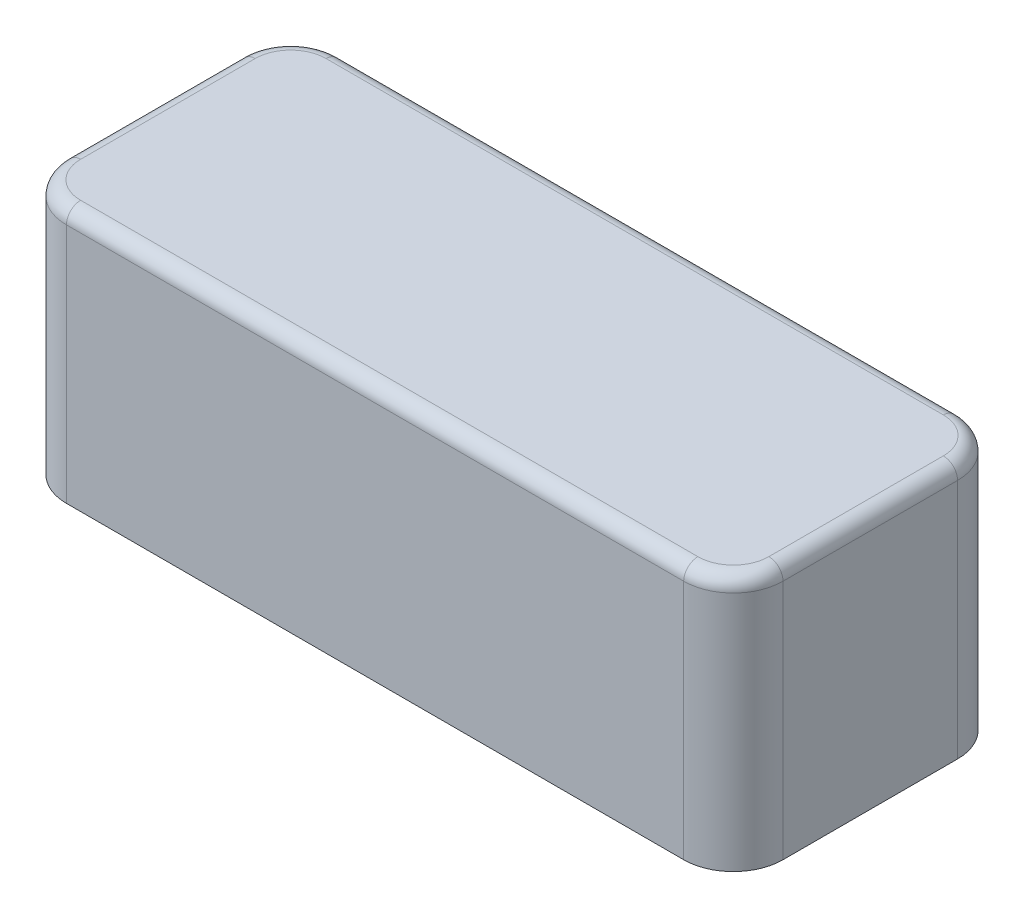
from build123d import *

# Parameters (mm, degrees)
BOSS_EXTRUDE1_DEPTH = 350
BOSS_EXTRUDE2_DEPTH = 10
FILLET1_R           = 20


with BuildPart() as part:
    # Sketch1 → Boss-Extrude1 (new body)
    with BuildSketch(Plane(origin=(0, 0, 0), x_dir=(1, 0, 0), z_dir=(0, 1, 0))):
        with BuildLine():
            Line((-505, -123), (-505, 123))
            ThreePointArc((-505, 123), (-484.497474683, 172.497474683), (-435, 193))
            Line((-435, 193), (435, 193))
            ThreePointArc((435, 193), (484.497474683, 172.497474683), (505, 123))
            Line((505, 123), (505, -123))
            ThreePointArc((505, -123), (484.497474683, -172.497474683), (435, -193))
            Line((435, -193), (-435, -193))
            ThreePointArc((-435, -193), (-484.497474683, -172.497474683), (-505, -123))
        make_face()
        with BuildLine():
            ThreePointArc((495, 123), (477.426406871, 165.426406871), (435, 183))
            Line((435, 183), (-435, 183))
            ThreePointArc((-435, 183), (-477.426406871, 165.426406871), (-495, 123))
            Line((-495, 123), (-495, -123))
            ThreePointArc((-495, -123), (-477.426406871, -165.426406871), (-435, -183))
            Line((-435, -183), (435, -183))
            ThreePointArc((435, -183), (477.426406871, -165.426406871), (495, -123))
            Line((495, -123), (495, 123))
        make_face(mode=Mode.SUBTRACT)
    extrude(amount=BOSS_EXTRUDE1_DEPTH)

    # Sketch2 → Boss-Extrude2 (add)
    with BuildSketch(Plane(origin=(0, 350, 0), x_dir=(1, 0, 0), z_dir=(0, 1, 0))):
        with BuildLine():
            Line((-435, -193), (435, -193))
            ThreePointArc((435, -193), (484.497474683, -172.497474683), (505, -123))
            Line((505, -123), (505, 123))
            ThreePointArc((505, 123), (484.497474683, 172.497474683), (435, 193))
            Line((435, 193), (-435, 193))
            ThreePointArc((-435, 193), (-484.497474683, 172.497474683), (-505, 123))
            Line((-505, 123), (-505, -123))
            ThreePointArc((-505, -123), (-484.497474683, -172.497474683), (-435, -193))
        make_face()
    extrude(amount=BOSS_EXTRUDE2_DEPTH)

    # Fillet1
    fillet1_edges = [part.edges().sort_by_distance(p)[0] for p in [
        (484.497474683, 360, -172.497474683),
        (0, 360, -193),
        (-484.497474683, 360, -172.497474683),
        (-505, 360, 0),
        (-484.497474683, 360, 172.497474683),
        (0, 360, 193),
        (484.497474683, 360, 172.497474683),
        (505, 360, 0),
    ]]
    fillet(fillet1_edges, radius=FILLET1_R)


solid = part.part
